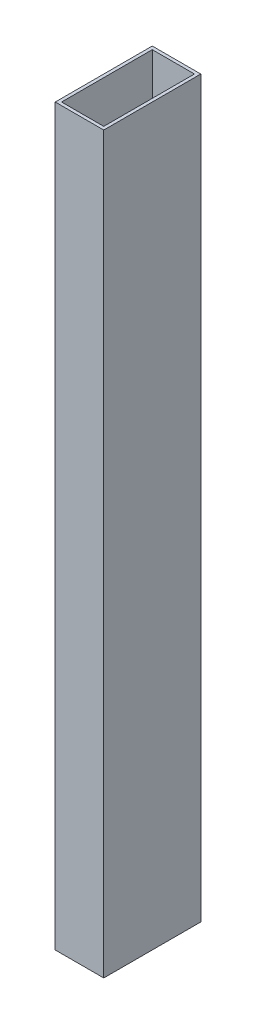
from build123d import *

# Parameters (mm, degrees)
SKETCH1_W               = 25.4
SKETCH1_H               = 50.8
BOSS_EXTRUDE1_DEPTH     = 384.556
CUT_EXTRUDE1_DEPTH      = 386.603121274
CUT_EXTRUDE1_DEPTH_BACK = 386.603121274
SKETCH2_W               = 22.098
SKETCH2_H               = 47.498


with BuildPart() as part:
    # Sketch1 → Boss-Extrude1 (new body)
    with BuildSketch(Plane(origin=(0, 0, 0), x_dir=(1, 0, 0), z_dir=(0, 1, 0))):
        Rectangle(SKETCH1_W, SKETCH1_H)
    extrude(amount=BOSS_EXTRUDE1_DEPTH)

    # Sketch2 → Cut-Extrude1 (cut, two sides: drawn at the far end of the back side and taken through both)
    with BuildSketch(Plane.XZ.offset(-CUT_EXTRUDE1_DEPTH_BACK)):
        Rectangle(SKETCH2_W, SKETCH2_H)
    extrude(amount=CUT_EXTRUDE1_DEPTH + CUT_EXTRUDE1_DEPTH_BACK, mode=Mode.SUBTRACT)


solid = part.part
